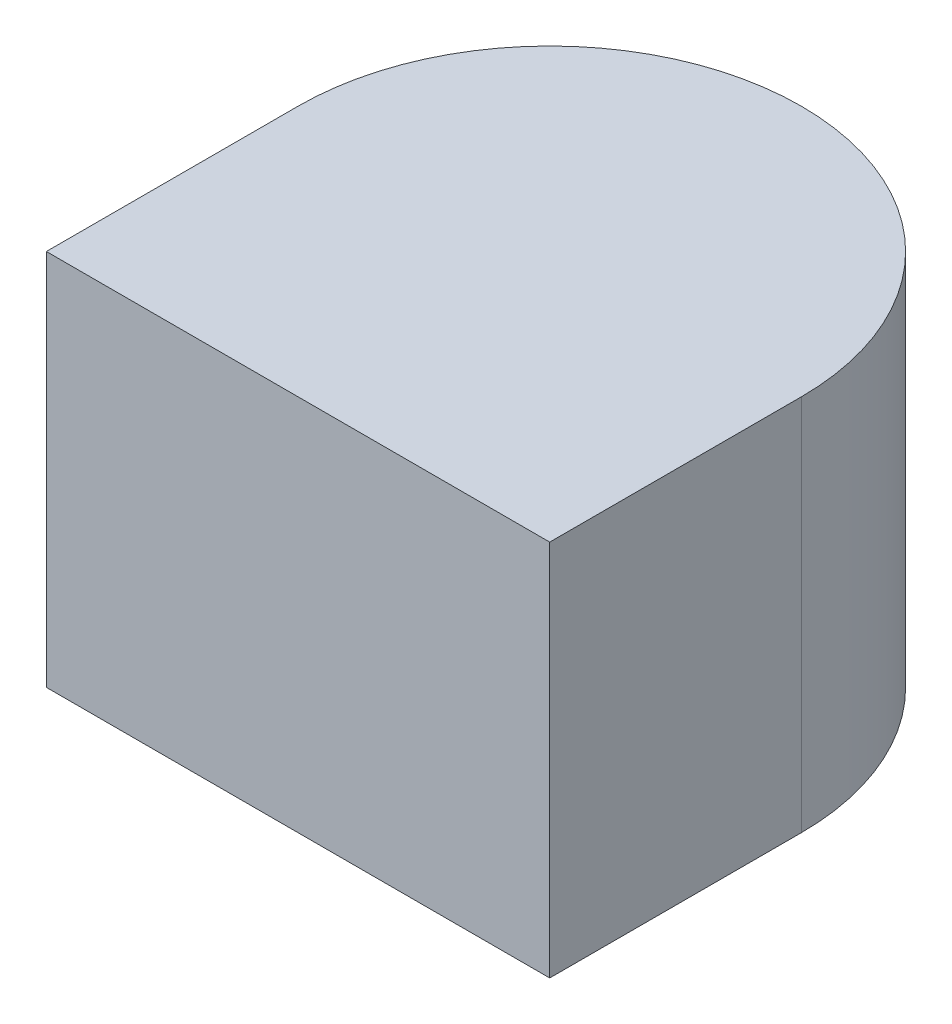
from build123d import *

# Parameters (mm, degrees)
BOSS_EXTRUDE1_DEPTH = 15


with BuildPart() as part:
    # Sketch1 → Boss-Extrude1 (new body)
    with BuildSketch(Plane(origin=(0, 0, 0), x_dir=(1, 0, 0), z_dir=(0, 1, 0))):
        with BuildLine():
            ThreePointArc((10, -10), (7.071067812, -2.928932188), (0, 0))
            Line((0, 0), (0, -20))
            Line((0, -20), (10, -20))
            Line((10, -20), (10, -10))
        make_face()
        with BuildLine():
            Line((0, -20), (0, 0))
            ThreePointArc((0, 0), (-7.071067812, -2.928932188), (-10, -10))
            Line((-10, -10), (-10, -20))
            Line((-10, -20), (0, -20))
        make_face()
    extrude(amount=BOSS_EXTRUDE1_DEPTH)


solid = part.part
